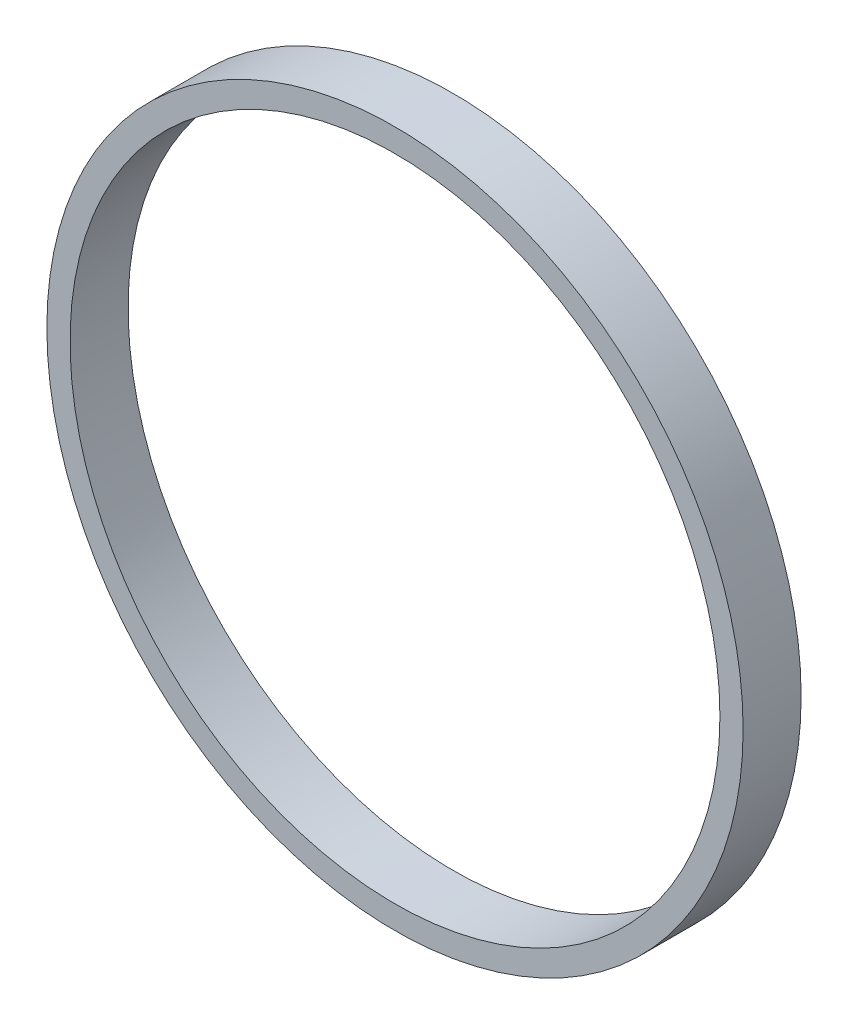
from build123d import *

# Parameters (mm, degrees)
SKETCH2_R           = 30
SKETCH2_R_2         = 28
BOSS_EXTRUDE2_DEPTH = 5


with BuildPart() as part:
    # Sketch2 → Boss-Extrude2 (new body)
    with BuildSketch(Plane.XY):
        Circle(SKETCH2_R)
        Circle(SKETCH2_R_2, mode=Mode.SUBTRACT)
    extrude(amount=BOSS_EXTRUDE2_DEPTH)


solid = part.part
